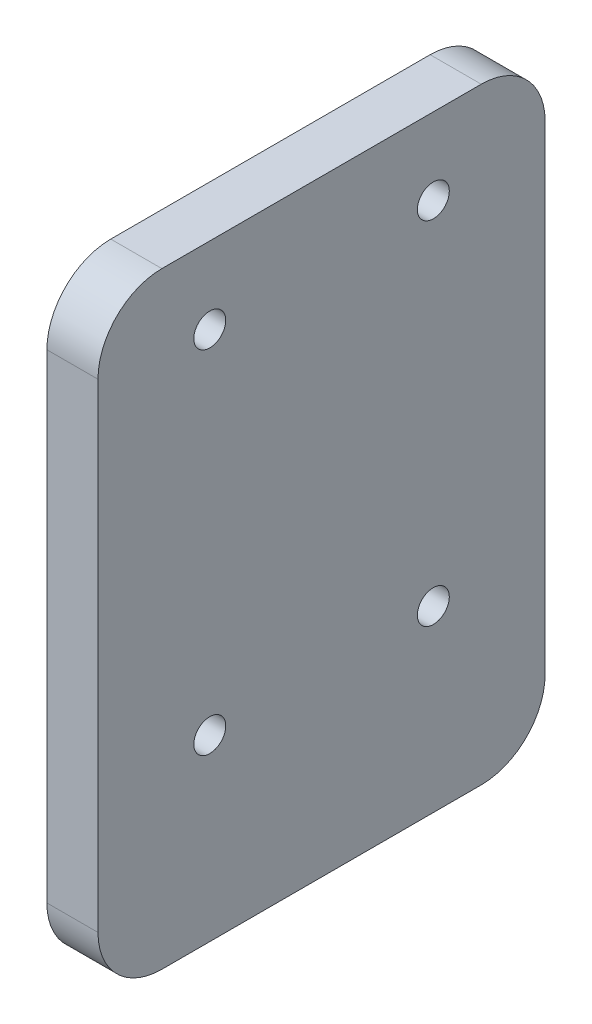
from build123d import *

# Parameters (mm, degrees)
SKETCH_1_W             = 70
SKETCH_1_H             = 95
EXTRUDE_1_DEPTH        = 8
HOLE_WIZARD_M6_1_D     = 5
HOLE_WIZARD_M6_1_DEPTH = 17
HOLE_WIZARD_M6_1_TIP   = 1.502151548
FILLET_1_R             = 10


with BuildPart() as part:
    # 草图1 → 凸台-拉伸1 (new body)
    with BuildSketch(Plane(origin=(0, 0, 0), x_dir=(0, 0, -1), z_dir=(1, 0, 0))):
        Rectangle(SKETCH_1_W, SKETCH_1_H)
    extrude(amount=EXTRUDE_1_DEPTH)

    # M6 螺纹孔1
    with Locations(Plane(origin=(8, 0, 0), x_dir=(0, 0, -1), z_dir=(1, 0, 0))):
        with Locations((-17.5, 35.5), (17.5, 35.5), (-17.5, -19.5), (17.5, -19.5)):
            Hole(HOLE_WIZARD_M6_1_D / 2, depth=HOLE_WIZARD_M6_1_DEPTH)
            with Locations((0, 0, -(HOLE_WIZARD_M6_1_DEPTH + HOLE_WIZARD_M6_1_TIP / 2))):  # 118° drill point
                Cone(0, HOLE_WIZARD_M6_1_D / 2, HOLE_WIZARD_M6_1_TIP, mode=Mode.SUBTRACT)

    # 圆角1
    fillet_1_edges = [part.edges().sort_by_distance(p)[0] for p in [
        (4, 47.5, 35),
        (4, 47.5, -35),
        (4, -47.5, -35),
        (4, -47.5, 35),
    ]]
    fillet(fillet_1_edges, radius=FILLET_1_R)


solid = part.part
